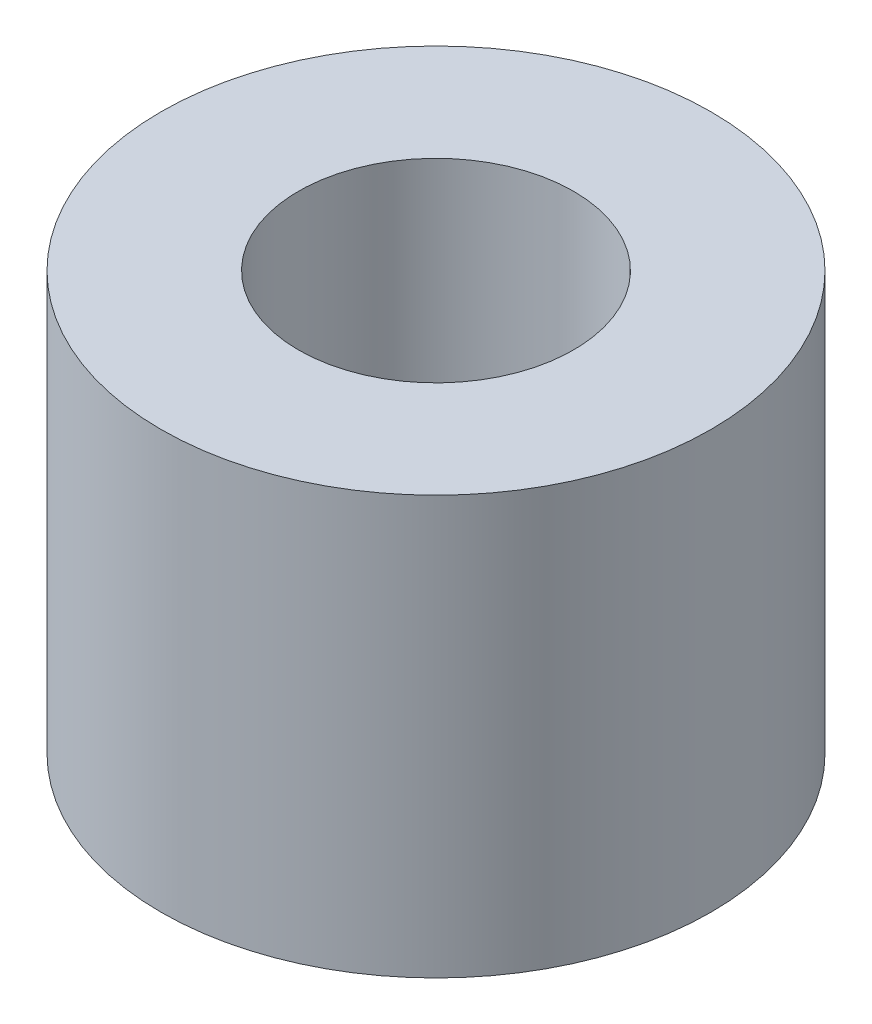
from build123d import *

# Parameters (mm, degrees)
SKETCH2_R           = 6.35
SKETCH2_R_2         = 3.175
BOSS_EXTRUDE1_DEPTH = 9.652


with BuildPart() as part:
    # Sketch2 → Boss-Extrude1 (new body)
    with BuildSketch(Plane(origin=(0, 0, 0), x_dir=(1, 0, 0), z_dir=(0, 1, 0))):
        with Locations(Location((0, 0, 0), (0, 0, 270))):
            Circle(SKETCH2_R)
        with Locations(Location((0, 0, 0), (0, 0, 270))):
            Circle(SKETCH2_R_2, mode=Mode.SUBTRACT)
    extrude(amount=BOSS_EXTRUDE1_DEPTH)


solid = part.part
